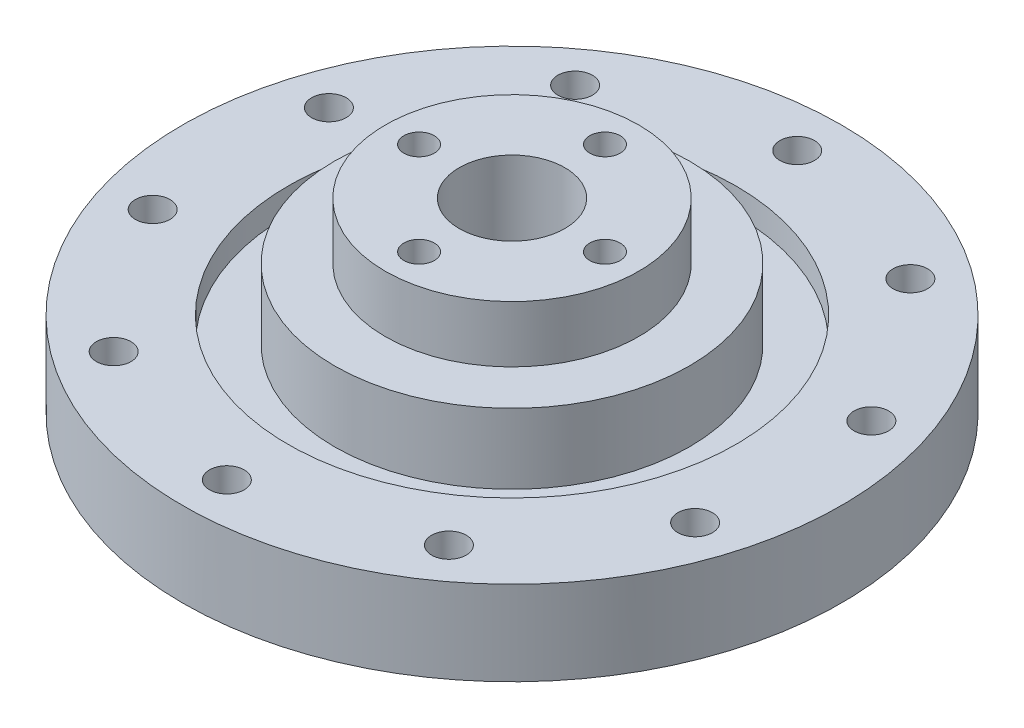
from build123d import *

# Parameters (mm, degrees)
SKETCH1_R                                           = 39
BOSS_EXTRUDE1_DEPTH                                 = 7
SKETCH3_R                                           = 17.5
BOSS_EXTRUDE2_DEPTH                                 = 1
SKETCH4_R                                           = 15
BOSS_EXTRUDE3_DEPTH                                 = 14
SKETCH5_R                                           = 6.25
SKETCH5_R_2                                         = 1.8
CUT_EXTRUDE1_DEPTH                                  = 60.380131357
CSK_FOR_M4_COUNTERSUNK_FLAT_HEAD_SCREW1_D           = 3.5
CSK_FOR_M4_COUNTERSUNK_FLAT_HEAD_SCREW1_CSINK_D     = 9.1
CSK_FOR_M4_COUNTERSUNK_FLAT_HEAD_SCREW1_CSINK_ANGLE = 90
SKETCH7_R                                           = 28.5
SKETCH7_R_2                                         = 26.5
BOSS_EXTRUDE4_DEPTH                                 = 10.5
CUT_EXTRUDE2_START                                  = -1
SKETCH8_R                                           = 26.5
SKETCH8_R_2                                         = 17.5
CUT_EXTRUDE2_DEPTH                                  = 1
SKETCH9_R                                           = 2.05
CUT_EXTRUDE3_DEPTH                                  = 58.157676676
BOSS_EXTRUDE5_DEPTH                                 = 10.5
CUT_EXTRUDE4_DEPTH                                  = 58.157676676
FILLET1_R                                           = 1
BOSS_EXTRUDE6_START                                 = -10
SKETCH12_R                                          = 39
SKETCH12_R_2                                        = 2.05
SKETCH12_R_3                                        = 19.105693395
BOSS_EXTRUDE6_DEPTH                                 = 10
SKETCH18_R                                          = 21
SKETCH18_R_2                                        = 15
BOSS_EXTRUDE9_DEPTH                                 = 9.3
CUT_EXTRUDE5_START                                  = -3
SKETCH19_R                                          = 26.5
SKETCH19_R_2                                        = 21
CUT_EXTRUDE5_DEPTH                                  = 3
CUT_EXTRUDE6_START                                  = -7.5
SKETCH20_R                                          = 36.5
SKETCH20_R_2                                        = 28.5
CUT_EXTRUDE6_DEPTH                                  = 7.5
CUT_EXTRUDE7_START                                  = -12
SKETCH21_R                                          = 28.5
SKETCH21_R_2                                        = 26.5
CUT_EXTRUDE7_DEPTH                                  = 12


with BuildPart() as part:
    # Sketch1 → Boss-Extrude1 (new body)
    with BuildSketch(Plane(origin=(0, 0, 0), x_dir=(1, 0, 0), z_dir=(0, 1, 0))):
        with Locations(Location((0, 0, 0), (0, 0, 270))):
            Circle(SKETCH1_R)
    extrude(amount=BOSS_EXTRUDE1_DEPTH)

    # Sketch3 → Boss-Extrude2 (add)
    with BuildSketch(Plane(origin=(0, 7, 0), x_dir=(1, 0, 0), z_dir=(0, 1, 0))):
        with Locations(Location((0, 0, 0), (0, 0, 270))):
            Circle(SKETCH3_R)
    extrude(amount=BOSS_EXTRUDE2_DEPTH)

    # Sketch4 → Boss-Extrude3 (add)
    with BuildSketch(Plane(origin=(0, 8, 0), x_dir=(1, 0, 0), z_dir=(0, 1, 0))):
        with Locations(Location((0, 0, 0), (0, 0, 270))):
            Circle(SKETCH4_R)
    extrude(amount=BOSS_EXTRUDE3_DEPTH)

    # Sketch5 → Cut-Extrude1 (cut, through all)
    with BuildSketch(Plane(origin=(0, 22, 0), x_dir=(1, 0, 0), z_dir=(0, 1, 0))):
        with Locations(Location((0, 0, 0), (0, 0, 270))):
            Circle(SKETCH5_R)
        with Locations(Location((0, 11, 0), (0, 0, 270))):
            Circle(SKETCH5_R_2)
        with Locations(Location((11, 0, 0), (0, 0, 270))):
            Circle(SKETCH5_R_2)
        with Locations(Location((0, -11, 0), (0, 0, 270))):
            Circle(SKETCH5_R_2)
        with Locations(Location((-11, 0, 0), (0, 0, 270))):
            Circle(SKETCH5_R_2)
    extrude(amount=-CUT_EXTRUDE1_DEPTH, mode=Mode.SUBTRACT)

    # CSK for M4 Countersunk Flat Head Screw1 (through all)
    with Locations(Plane(origin=(11, 0, 0), x_dir=(0, 0, -1), z_dir=(0, -1, 0))):
        with Locations((0, 0), (11, -11), (0, -22), (-11, -11)):
            CounterSinkHole(CSK_FOR_M4_COUNTERSUNK_FLAT_HEAD_SCREW1_D / 2, CSK_FOR_M4_COUNTERSUNK_FLAT_HEAD_SCREW1_CSINK_D / 2, counter_sink_angle=CSK_FOR_M4_COUNTERSUNK_FLAT_HEAD_SCREW1_CSINK_ANGLE)

    # Sketch7 → Boss-Extrude4 (add)
    with BuildSketch(Plane(origin=(0, 7, 0), x_dir=(1, 0, 0), z_dir=(0, 1, 0))):
        with Locations(Location((0, 0, 0), (0, 0, 90))):
            Circle(SKETCH7_R)
        with Locations(Location((0, 0, 0), (0, 0, 90))):
            Circle(SKETCH7_R_2, mode=Mode.SUBTRACT)
    extrude(amount=BOSS_EXTRUDE4_DEPTH)

    # Sketch8 → Cut-Extrude2 (cut)
    with BuildSketch(Plane(origin=(0, 7, 0), x_dir=(1, 0, 0), z_dir=(0, 1, 0)).offset(CUT_EXTRUDE2_START)):
        with Locations(Location((0, 0, 0), (0, 0, 90))):
            Circle(SKETCH8_R)
        with Locations(Location((0, 0, 0), (0, 0, 270))):
            Circle(SKETCH8_R_2, mode=Mode.SUBTRACT)
    extrude(amount=CUT_EXTRUDE2_DEPTH, mode=Mode.SUBTRACT)

    # Sketch9 → Cut-Extrude3 (cut, through all)
    with BuildSketch(Plane(origin=(0, 7, 0), x_dir=(1, 0, 0), z_dir=(0, 1, 0))):
        with Locations(Location((0, 33.75, 0), (0, 0, 270))):
            Circle(SKETCH9_R)
        with Locations(Location((19.837752265, 27.30432356, 0), (0, 0, 270))):
            Circle(SKETCH9_R)
        with Locations(Location((32.098157425, 10.42932356, 0), (0, 0, 270))):
            Circle(SKETCH9_R)
        with Locations(Location((32.098157425, -10.42932356, 0), (0, 0, 270))):
            Circle(SKETCH9_R)
        with Locations(Location((19.837752265, -27.30432356, 0), (0, 0, 270))):
            Circle(SKETCH9_R)
        with Locations(Location((0, -33.75, 0), (0, 0, 270))):
            Circle(SKETCH9_R)
        with Locations(Location((-19.837752265, -27.30432356, 0), (0, 0, 270))):
            Circle(SKETCH9_R)
        with Locations(Location((-32.098157425, -10.42932356, 0), (0, 0, 270))):
            Circle(SKETCH9_R)
        with Locations(Location((-32.098157425, 10.42932356, 0), (0, 0, 270))):
            Circle(SKETCH9_R)
        with Locations(Location((-19.837752265, 27.30432356, 0), (0, 0, 270))):
            Circle(SKETCH9_R)
    extrude(amount=-CUT_EXTRUDE3_DEPTH, mode=Mode.SUBTRACT)

    # Sketch10 → Boss-Extrude5 (add)
    with BuildSketch(Plane(origin=(0, 7, 0), x_dir=(1, 0, 0), z_dir=(0, 1, 0))):
        with BuildLine():
            Line((-33.5, 3), (-28.341665442, 3))
            ThreePointArc((-28.341665442, 3), (-28.5, 0), (-28.341665442, -3))
            Line((-28.341665442, -3), (-33.5, -3))
            ThreePointArc((-33.5, -3), (-36.5, 0), (-33.5, 3))
        make_face()
    extrude(amount=BOSS_EXTRUDE5_DEPTH)

    # Sketch11 → Cut-Extrude4 (cut, through all)
    with BuildSketch(Plane(origin=(0, 7, 0), x_dir=(1, 0, 0), z_dir=(0, 1, 0))):
        with BuildLine():
            Line((35, 4.55), (38.73367398, 4.55))
            ThreePointArc((38.73367398, 4.55), (39, 0), (38.73367398, -4.55))
            Line((38.73367398, -4.55), (35, -4.55))
            ThreePointArc((35, -4.55), (30.45, 0), (35, 4.55))
        make_face()
    extrude(amount=-CUT_EXTRUDE4_DEPTH, mode=Mode.SUBTRACT)

    # Fillet1
    fillet1_edges = [part.edges().sort_by_distance(p)[0] for p in [
        (38.73367398, 3.5, -4.55),
        (38.73367398, 3.5, 4.55),
    ]]
    fillet(fillet1_edges, radius=FILLET1_R)

    # Sketch12 → Boss-Extrude6 (add)
    with BuildSketch(Plane.XZ.offset(BOSS_EXTRUDE6_START)):
        with Locations(Location((0, 0, 0), (0, 0, 270))):
            Circle(SKETCH12_R)
        with Locations(Location((0, 33.75, 0), (0, 0, 90))):
            Circle(SKETCH12_R_2, mode=Mode.SUBTRACT)
        with Locations(Location((0, 0, 0), (0, 0, 270))):
            Circle(SKETCH12_R_3, mode=Mode.SUBTRACT)
        with Locations(Location((19.837752265, 27.30432356, 0), (0, 0, 90))):
            Circle(SKETCH12_R_2, mode=Mode.SUBTRACT)
        with Locations(Location((32.098157425, 10.42932356, 0), (0, 0, 90))):
            Circle(SKETCH12_R_2, mode=Mode.SUBTRACT)
        with Locations(Location((32.098157425, -10.42932356, 0), (0, 0, 90))):
            Circle(SKETCH12_R_2, mode=Mode.SUBTRACT)
        with Locations(Location((19.837752265, -27.30432356, 0), (0, 0, 90))):
            Circle(SKETCH12_R_2, mode=Mode.SUBTRACT)
        with Locations(Location((0, -33.75, 0), (0, 0, 90))):
            Circle(SKETCH12_R_2, mode=Mode.SUBTRACT)
        with Locations(Location((-19.837752265, -27.30432356, 0), (0, 0, 90))):
            Circle(SKETCH12_R_2, mode=Mode.SUBTRACT)
        with Locations(Location((-32.098157425, -10.42932356, 0), (0, 0, 90))):
            Circle(SKETCH12_R_2, mode=Mode.SUBTRACT)
        with Locations(Location((-32.098157425, 10.42932356, 0), (0, 0, 90))):
            Circle(SKETCH12_R_2, mode=Mode.SUBTRACT)
        with Locations(Location((-19.837752265, 27.30432356, 0), (0, 0, 90))):
            Circle(SKETCH12_R_2, mode=Mode.SUBTRACT)
    extrude(amount=BOSS_EXTRUDE6_DEPTH)

    # Sketch18 → Boss-Extrude9 (add)
    with BuildSketch(Plane(origin=(0, 6, 0), x_dir=(1, 0, 0), z_dir=(0, 1, 0))):
        with Locations(Location((0, 0, 0), (0, 0, 90))):
            Circle(SKETCH18_R)
        with Locations(Location((0, 0, 0), (0, 0, 270))):
            Circle(SKETCH18_R_2, mode=Mode.SUBTRACT)
    extrude(amount=BOSS_EXTRUDE9_DEPTH)

    # Sketch19 → Cut-Extrude5 (cut)
    with BuildSketch(Plane(origin=(0, 10, 0), x_dir=(1, 0, 0), z_dir=(0, 1, 0)).offset(CUT_EXTRUDE5_START)):
        with Locations(Location((0, 0, 0), (0, 0, 90))):
            Circle(SKETCH19_R)
        with Locations(Location((0, 0, 0), (0, 0, 270))):
            Circle(SKETCH19_R_2, mode=Mode.SUBTRACT)
    extrude(amount=CUT_EXTRUDE5_DEPTH, mode=Mode.SUBTRACT)

    # Sketch20 → Cut-Extrude6 (cut)
    with BuildSketch(Plane(origin=(0, 17.5, 0), x_dir=(1, 0, 0), z_dir=(0, 1, 0)).offset(CUT_EXTRUDE6_START)):
        Circle(SKETCH20_R)
        with Locations(Location((0, 0, 0), (0, 0, 90))):
            Circle(SKETCH20_R_2, mode=Mode.SUBTRACT)
    extrude(amount=CUT_EXTRUDE6_DEPTH, mode=Mode.SUBTRACT)

    # Sketch21 → Cut-Extrude7 (cut)
    with BuildSketch(Plane(origin=(0, 22, 0), x_dir=(1, 0, 0), z_dir=(0, 1, 0)).offset(CUT_EXTRUDE7_START)):
        Circle(SKETCH21_R)
        with Locations(Location((0, 0, 0), (0, 0, 90))):
            Circle(SKETCH21_R_2, mode=Mode.SUBTRACT)
    extrude(amount=CUT_EXTRUDE7_DEPTH, mode=Mode.SUBTRACT)


solid = part.part
